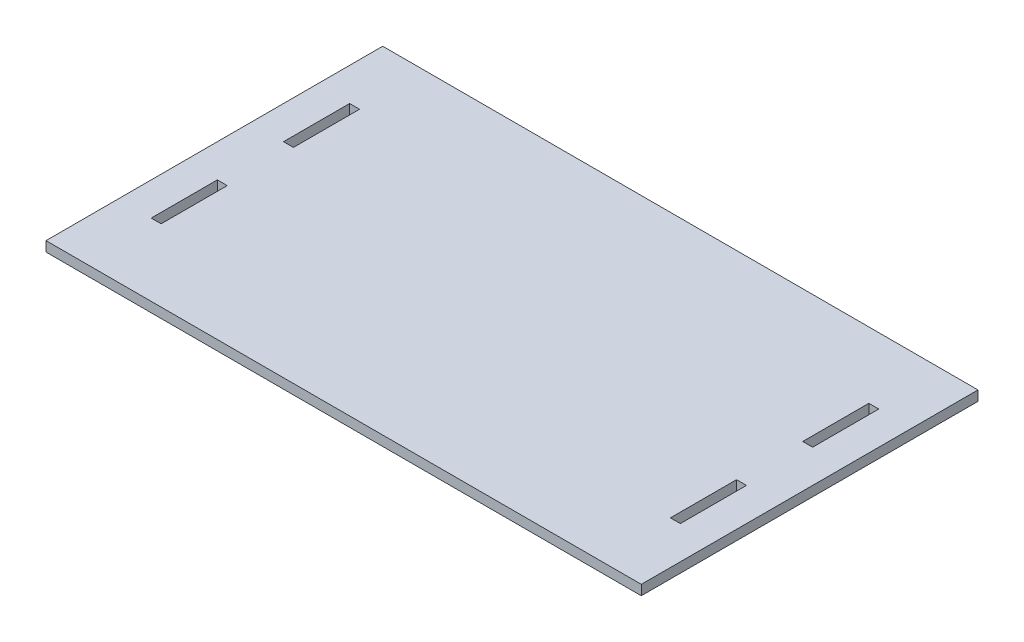
from build123d import *

# Parameters (mm, degrees)
SKETCH1_W           = 180
SKETCH1_H           = 101.81
BOSS_EXTRUDE1_DEPTH = 3
SKETCH2_W           = 3
SKETCH2_H           = 20
CUT_EXTRUDE1_DEPTH  = 3


with BuildPart() as part:
    # Sketch1 → Boss-Extrude1 (new body)
    with BuildSketch(Plane(origin=(0, 0, 0), x_dir=(1, 0, 0), z_dir=(0, 1, 0))):
        with Locations((90, 50.905)):
            Rectangle(SKETCH1_W, SKETCH1_H)
    extrude(amount=BOSS_EXTRUDE1_DEPTH)

    # Sketch2 → Cut-Extrude1 (cut)
    with BuildSketch(Plane(origin=(0, 3, 0), x_dir=(1, 0, 0), z_dir=(0, 1, 0))):
        with Locations((11.5, 71.80661572)):
            Rectangle(SKETCH2_W, SKETCH2_H)
        with Locations((11.5, 31.80661572)):
            Rectangle(SKETCH2_W, SKETCH2_H)
        with Locations((168.5, 71.80661572)):
            Rectangle(SKETCH2_W, SKETCH2_H)
        with Locations((168.5, 31.80661572)):
            Rectangle(SKETCH2_W, SKETCH2_H)
    extrude(amount=-CUT_EXTRUDE1_DEPTH, mode=Mode.SUBTRACT)


solid = part.part
